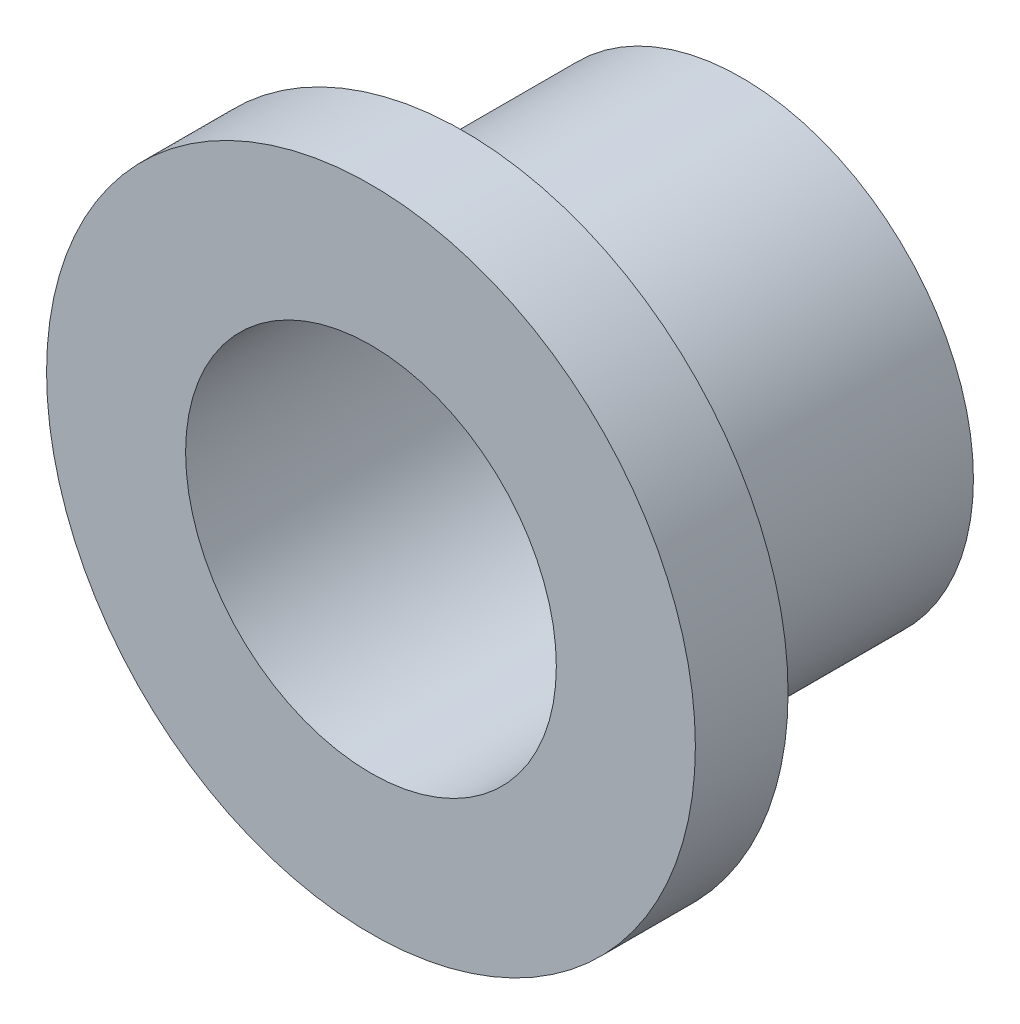
from build123d import *


with BuildPart() as part:
    # Sketch1 → Revolve1 (revolve)
    with BuildSketch(Plane(origin=(0, 0, 0), x_dir=(0, 0, -1), z_dir=(1, 0, 0)), mode=Mode.PRIVATE) as revolve1_sk:
        Polygon((0, 6.35), (0, 11.1125), (3.175, 11.1125), (3.175, 7.9375), (12.7, 7.9375), (12.7, 6.35), align=None)
    revolve(revolve1_sk.sketch.rotate(Axis((0, 0, 0), (0, 0, -1)), 90), axis=Axis((0, 0, 0), (0, 0, -1)))


solid = part.part
